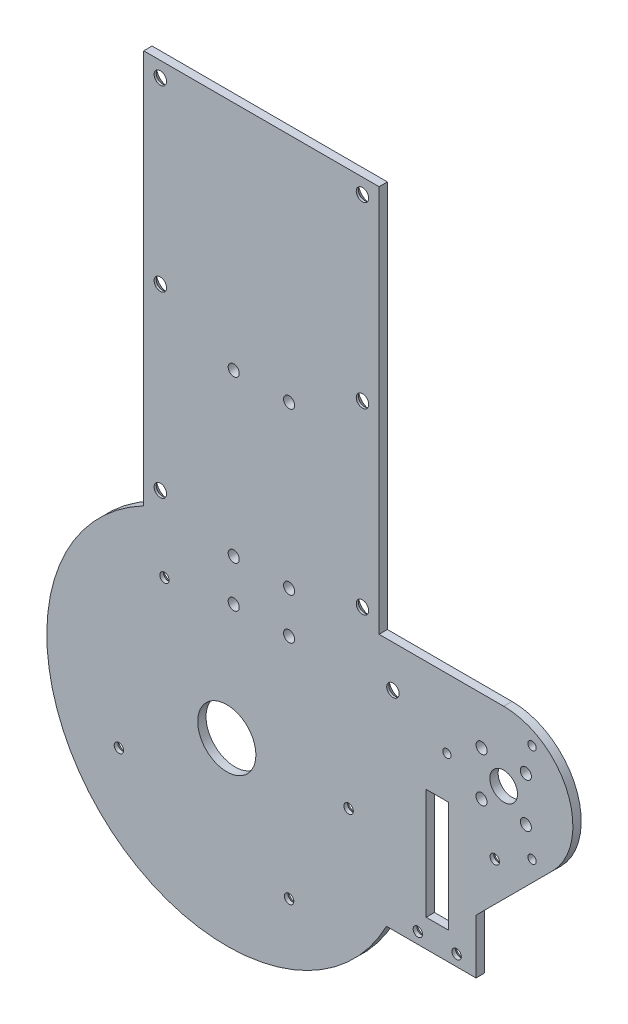
from build123d import *
from build123d.topology import SkipClean

# Parameters (mm, degrees)
SKETCH1_R                     = 10.5
SKETCH1_W                     = 8
SKETCH1_H                     = 40
SKETCH1_R_2                   = 5
BOSS_EXTRUDE1_DEPTH           = 3
CUT_EXTRUDE1_REACH            = 140.687
SKETCH2_R                     = 2
BOSS_EXTRUDE2_DEPTH           = 3
SKETCH5_R                     = 2
CUT_EXTRUDE2_DEPTH            = 10
BOSS_EXTRUDE4_START           = -3
BOSS_EXTRUDE4_DEPTH           = 3
BOSS_EXTRUDE5_START           = -3
SKETCH8_R                     = 65
SKETCH8_R_2                   = 10.5
BOSS_EXTRUDE5_DEPTH           = 3
CUT_EXTRUDE4_START            = -10
CUT_EXTRUDE4_DEPTH            = 10
CUT_EXTRUDE6_REACH            = 237.869
SKETCH11_R                    = 2
CUT_EXTRUDE7_REACH            = 237.869
SKETCH12_R                    = 2
CSK_FOR_M3_SFHCS1_D           = 3.4
CSK_FOR_M3_SFHCS1_DEPTH       = 11.3
CSK_FOR_M3_SFHCS1_CSINK_D     = 6.72
CSK_FOR_M3_SFHCS1_CSINK_ANGLE = 90
CSK_FOR_M3_SFHCS1_TIP         = 1.021463052
CSK_FOR_M4_SFHCS1_D           = 4.5
CSK_FOR_M4_SFHCS1_DEPTH       = 11.3
CSK_FOR_M4_SFHCS1_CSINK_D     = 8.96
CSK_FOR_M4_SFHCS1_CSINK_ANGLE = 90
CSK_FOR_M4_SFHCS1_TIP         = 1.351936393
CSK_FOR_M3_SFHCS2_D           = 3.4
CSK_FOR_M3_SFHCS2_DEPTH       = 11.3
CSK_FOR_M3_SFHCS2_CSINK_D     = 6.72
CSK_FOR_M3_SFHCS2_CSINK_ANGLE = 90
CSK_FOR_M3_SFHCS2_TIP         = 1.021463052
CSK_FOR_M4_SFHCS2_D           = 4.5
CSK_FOR_M4_SFHCS2_DEPTH       = 11.3
CSK_FOR_M4_SFHCS2_CSINK_D     = 8.96
CSK_FOR_M4_SFHCS2_CSINK_ANGLE = 90
CSK_FOR_M4_SFHCS2_TIP         = 1.351936393
CUT_EXTRUDE8_REACH            = 237.869
SKETCH23_R                    = 1.5
CSK_FOR_M3_SFHCS3_D           = 3.4
CSK_FOR_M3_SFHCS3_DEPTH       = 11.3
CSK_FOR_M3_SFHCS3_CSINK_D     = 6.72
CSK_FOR_M3_SFHCS3_CSINK_ANGLE = 90
CSK_FOR_M3_SFHCS3_TIP         = 1.021463052


with BuildPart() as part:
    # Sketch1 → Boss-Extrude1 (new body)
    # profile 1 of 2: a face of its own
    with BuildSketch(Plane.XY):
        with BuildLine():
            ThreePointArc((-60, 0), (-52.867640737, 28.372743309), (-33.166247904, 50))
            Line((-33.166247904, 50), (-60, 50))
            Line((-60, 50), (-60, 0))
        make_face()
    # profile 2 of 2: a face of its own
    with BuildSketch(Plane.XY):
        with BuildLine():
            ThreePointArc((0, 60), (-17.320508076, 57.445626465), (-33.166247904, 50))
            ThreePointArc((-33.166247904, 50), (-52.867640737, 28.372743309), (-60, 0))
            ThreePointArc((-60, 0), (-15.529142706, -57.955549577), (51.961524227, -30))
            Line((51.961524227, -30), (56.882127578, -30))
            Line((56.882127578, -30), (90, -30))
            Line((90, -30), (90, -10.355339059))
            Line((90, -10.355339059), (117.67766953, 17.32233047))
            ThreePointArc((117.67766953, 17.32233047), (123.096988313, 44.567085809), (100, 60))
            Line((100, 60), (0, 60))
        make_face()
        Circle(SKETCH1_R, mode=Mode.SUBTRACT)
        with Locations((76, 0)):
            Rectangle(SKETCH1_W, SKETCH1_H, mode=Mode.SUBTRACT)
        with Locations((100, 35)):
            Circle(SKETCH1_R_2, mode=Mode.SUBTRACT)
    extrude(amount=BOSS_EXTRUDE1_DEPTH)

    # Sketch2 → Cut-Extrude1 (cut, up to next)
    with BuildSketch(Plane.XY.offset(3), mode=Mode.PRIVATE) as cut_extrude1_sk1:
        with Locations((60, 45)):
            Circle(SKETCH2_R)
    cut_extrude1_tool1 = extrude(cut_extrude1_sk1.sketch, amount=-CUT_EXTRUDE1_REACH, mode=Mode.PRIVATE) & part.part
    add(cut_extrude1_tool1.solids().sort_by_distance((60, 45, 3))[0], mode=Mode.SUBTRACT)

    # Sketch3 → Boss-Extrude2 (add)
    with BuildSketch(Plane(origin=(0, 0, 0), x_dir=(-1, 0, 0), z_dir=(0, 0, -1))):
        with BuildLine():
            Line((-30, 80), (-30, 60))
            Line((-30, 60), (0, 60))
            ThreePointArc((0, 60), (2.502176759, 59.947803225), (5, 59.791303716))
            Line((5, 59.791303716), (5, 80))
            Line((5, 80), (-30, 80))
        make_face()
    extrude(amount=-BOSS_EXTRUDE2_DEPTH)

    # Sketch5 → Cut-Extrude2 (cut)
    with BuildSketch(Plane.XY.offset(3)):
        with Locations((92, 43)):
            Circle(SKETCH5_R)
        with Locations((108, 43)):
            Circle(SKETCH5_R)
        with Locations((108, 27)):
            Circle(SKETCH5_R)
        with Locations((92, 27)):
            Circle(SKETCH5_R)
    extrude(amount=-CUT_EXTRUDE2_DEPTH, mode=Mode.SUBTRACT)

    # Sketch6 → Boss-Extrude4 (add)
    with BuildSketch(Plane.XY.offset(3).offset(BOSS_EXTRUDE4_START)):
        with BuildLine():
            Line((12.5, 60), (55, 60))
            Line((55, 60), (55, 200))
            Line((55, 200), (-30, 200))
            Line((-30, 200), (-30, 60))
            Line((-30, 60), (-30, 51.961524227))
            ThreePointArc((-30, 51.961524227), (-17.93255034, 57.257520364), (-5, 59.791303716))
            Line((-5, 59.791303716), (-5, 60))
            Line((-5, 60), (12.5, 60))
        make_face()
    extrude(amount=BOSS_EXTRUDE4_DEPTH)

    # Sketch8 → Boss-Extrude5 (add)
    with BuildSketch(Plane.XY.offset(3).offset(BOSS_EXTRUDE5_START)):
        Circle(SKETCH8_R)
        Circle(SKETCH8_R_2, mode=Mode.SUBTRACT)
    extrude(amount=BOSS_EXTRUDE5_DEPTH)

    # Sketch9 → Cut-Extrude4 (cut)
    with SkipClean():  # the faces are left unmerged after this step: merging them gives an invalid solid
        with BuildSketch(Plane.XY.offset(3).offset(CUT_EXTRUDE4_START)):
            with BuildLine():
                Line((-60, 50), (-60, 25))
                ThreePointArc((-60, 25), (-52.282822987, 38.62002616), (-41.533119315, 50))
                Line((-41.533119315, 50), (-60, 50))
            make_face()
        extrude(amount=CUT_EXTRUDE4_DEPTH, mode=Mode.SUBTRACT)

    # Sketch11 → Cut-Extrude6 (cut, up to next)
    with BuildSketch(Plane(origin=(0, 0, 0), x_dir=(-1, 0, 0), z_dir=(0, 0, -1)), mode=Mode.PRIVATE) as cut_extrude6_sk1:
        with Locations((-2.5, 116.34)):
            Circle(SKETCH11_R)
    cut_extrude6_tool1 = extrude(cut_extrude6_sk1.sketch, amount=-CUT_EXTRUDE6_REACH, mode=Mode.PRIVATE) & part.part
    # Sketch11 → Cut-Extrude6 (cut, up to next)
    with BuildSketch(Plane(origin=(0, 0, 0), x_dir=(-1, 0, 0), z_dir=(0, 0, -1)), mode=Mode.PRIVATE) as cut_extrude6_sk2:
        with Locations((-22.5, 116.34)):
            Circle(SKETCH11_R)
    cut_extrude6_tool2 = extrude(cut_extrude6_sk2.sketch, amount=-CUT_EXTRUDE6_REACH, mode=Mode.PRIVATE) & part.part
    add(cut_extrude6_tool1.solids().sort_by_distance((2.5, 116.34, 0))[0], mode=Mode.SUBTRACT)
    add(cut_extrude6_tool2.solids().sort_by_distance((22.5, 116.34, 0))[0], mode=Mode.SUBTRACT)

    # Sketch12 → Cut-Extrude7 (cut, up to next)
    with BuildSketch(Plane(origin=(0, 0, 0), x_dir=(-1, 0, 0), z_dir=(0, 0, -1)), mode=Mode.PRIVATE) as cut_extrude7_sk1:
        with Locations((-2.5, 58.160508076)):
            Circle(SKETCH12_R)
    cut_extrude7_tool1 = extrude(cut_extrude7_sk1.sketch, amount=-CUT_EXTRUDE7_REACH, mode=Mode.PRIVATE) & part.part
    # Sketch12 → Cut-Extrude7 (cut, up to next)
    with BuildSketch(Plane(origin=(0, 0, 0), x_dir=(-1, 0, 0), z_dir=(0, 0, -1)), mode=Mode.PRIVATE) as cut_extrude7_sk2:
        with Locations((-22.5, 58.160508076)):
            Circle(SKETCH12_R)
    cut_extrude7_tool2 = extrude(cut_extrude7_sk2.sketch, amount=-CUT_EXTRUDE7_REACH, mode=Mode.PRIVATE) & part.part
    # Sketch12 → Cut-Extrude7 (cut, up to next)
    with BuildSketch(Plane(origin=(0, 0, 0), x_dir=(-1, 0, 0), z_dir=(0, 0, -1)), mode=Mode.PRIVATE) as cut_extrude7_sk3:
        with Locations((-2.5, 43.160508076)):
            Circle(SKETCH12_R)
    cut_extrude7_tool3 = extrude(cut_extrude7_sk3.sketch, amount=-CUT_EXTRUDE7_REACH, mode=Mode.PRIVATE) & part.part
    # Sketch12 → Cut-Extrude7 (cut, up to next)
    with BuildSketch(Plane(origin=(0, 0, 0), x_dir=(-1, 0, 0), z_dir=(0, 0, -1)), mode=Mode.PRIVATE) as cut_extrude7_sk4:
        with Locations((-22.5, 43.160508076)):
            Circle(SKETCH12_R)
    cut_extrude7_tool4 = extrude(cut_extrude7_sk4.sketch, amount=-CUT_EXTRUDE7_REACH, mode=Mode.PRIVATE) & part.part
    add(cut_extrude7_tool1.solids().sort_by_distance((2.5, 58.160508, 0))[0], mode=Mode.SUBTRACT)
    add(cut_extrude7_tool2.solids().sort_by_distance((22.5, 58.160508, 0))[0], mode=Mode.SUBTRACT)
    add(cut_extrude7_tool3.solids().sort_by_distance((2.5, 43.160508, 0))[0], mode=Mode.SUBTRACT)
    add(cut_extrude7_tool4.solids().sort_by_distance((22.5, 43.160508, 0))[0], mode=Mode.SUBTRACT)

    # CSK for M3 SFHCS1
    with Locations(Plane(origin=(0, 0, 0), x_dir=(-1, 0, 0), z_dir=(0, 0, -1))):
        with Locations((22.5, 38.97114317), (38.97114317, -22.5), (-22.5, -38.97114317), (-96.767766953, 10.554563517)):
            CounterSinkHole(CSK_FOR_M3_SFHCS1_D / 2, CSK_FOR_M3_SFHCS1_CSINK_D / 2, depth=CSK_FOR_M3_SFHCS1_DEPTH, counter_sink_angle=CSK_FOR_M3_SFHCS1_CSINK_ANGLE)
            with Locations((0, 0, -(CSK_FOR_M3_SFHCS1_DEPTH + CSK_FOR_M3_SFHCS1_TIP / 2))):  # 118° drill point
                Cone(0, CSK_FOR_M3_SFHCS1_D / 2, CSK_FOR_M3_SFHCS1_TIP, mode=Mode.SUBTRACT)

    # CSK for M4 SFHCS1
    with Locations(Plane(origin=(0, 0, 0), x_dir=(-1, 0, 0), z_dir=(0, 0, -1))):
        with Locations((-49, 194.5), (24, 194.5), (24, 130), (-49, 130), (-49, 65.5), (24, 65.5)):
            CounterSinkHole(CSK_FOR_M4_SFHCS1_D / 2, CSK_FOR_M4_SFHCS1_CSINK_D / 2, depth=CSK_FOR_M4_SFHCS1_DEPTH, counter_sink_angle=CSK_FOR_M4_SFHCS1_CSINK_ANGLE)
            with Locations((0, 0, -(CSK_FOR_M4_SFHCS1_DEPTH + CSK_FOR_M4_SFHCS1_TIP / 2))):  # 118° drill point
                Cone(0, CSK_FOR_M4_SFHCS1_D / 2, CSK_FOR_M4_SFHCS1_TIP, mode=Mode.SUBTRACT)

    # CSK for M3 SFHCS2
    with Locations(Plane(origin=(0, 0, 0), x_dir=(-1, 0, 0), z_dir=(0, 0, -1))):
        with Locations((-83, -26), (-69, -26)):
            CounterSinkHole(CSK_FOR_M3_SFHCS2_D / 2, CSK_FOR_M3_SFHCS2_CSINK_D / 2, depth=CSK_FOR_M3_SFHCS2_DEPTH, counter_sink_angle=CSK_FOR_M3_SFHCS2_CSINK_ANGLE)
            with Locations((0, 0, -(CSK_FOR_M3_SFHCS2_DEPTH + CSK_FOR_M3_SFHCS2_TIP / 2))):  # 118° drill point
                Cone(0, CSK_FOR_M3_SFHCS2_D / 2, CSK_FOR_M3_SFHCS2_TIP, mode=Mode.SUBTRACT)

    # CSK for M4 SFHCS2
    with Locations(Plane(origin=(0, 0, 0), x_dir=(-1, 0, 0), z_dir=(0, 0, -1))):
        with Locations((-60, 45)):
            CounterSinkHole(CSK_FOR_M4_SFHCS2_D / 2, CSK_FOR_M4_SFHCS2_CSINK_D / 2, depth=CSK_FOR_M4_SFHCS2_DEPTH, counter_sink_angle=CSK_FOR_M4_SFHCS2_CSINK_ANGLE)
            with Locations((0, 0, -(CSK_FOR_M4_SFHCS2_DEPTH + CSK_FOR_M4_SFHCS2_TIP / 2))):  # 118° drill point
                Cone(0, CSK_FOR_M4_SFHCS2_D / 2, CSK_FOR_M4_SFHCS2_TIP, mode=Mode.SUBTRACT)

    # Sketch23 → Cut-Extrude8 (cut, up to next)
    with BuildSketch(Plane(origin=(0, 0, 0), x_dir=(-1, 0, 0), z_dir=(0, 0, -1)), mode=Mode.PRIVATE) as cut_extrude8_sk1:
        with Locations((-79.5, 35)):
            Circle(SKETCH23_R)
    cut_extrude8_tool1 = extrude(cut_extrude8_sk1.sketch, amount=-CUT_EXTRUDE8_REACH, mode=Mode.PRIVATE) & part.part
    # Sketch23 → Cut-Extrude8 (cut, up to next)
    with BuildSketch(Plane(origin=(0, 0, 0), x_dir=(-1, 0, 0), z_dir=(0, 0, -1)), mode=Mode.PRIVATE) as cut_extrude8_sk2:
        with Locations((-110.25, 17.246479222)):
            Circle(SKETCH23_R)
    cut_extrude8_tool2 = extrude(cut_extrude8_sk2.sketch, amount=-CUT_EXTRUDE8_REACH, mode=Mode.PRIVATE) & part.part
    # Sketch23 → Cut-Extrude8 (cut, up to next)
    with BuildSketch(Plane(origin=(0, 0, 0), x_dir=(-1, 0, 0), z_dir=(0, 0, -1)), mode=Mode.PRIVATE) as cut_extrude8_sk3:
        with Locations((-110.25, 52.753520778)):
            Circle(SKETCH23_R)
    cut_extrude8_tool3 = extrude(cut_extrude8_sk3.sketch, amount=-CUT_EXTRUDE8_REACH, mode=Mode.PRIVATE) & part.part
    add(cut_extrude8_tool1.solids().sort_by_distance((79.5, 35, 0))[0], mode=Mode.SUBTRACT)
    add(cut_extrude8_tool2.solids().sort_by_distance((110.25, 17.246479, 0))[0], mode=Mode.SUBTRACT)
    add(cut_extrude8_tool3.solids().sort_by_distance((110.25, 52.753521, 0))[0], mode=Mode.SUBTRACT)

    # CSK for M3 SFHCS3
    with Locations(Plane(origin=(0, 0, 0), x_dir=(-1, 0, 0), z_dir=(0, 0, -1))):
        with Locations((-44, 0)):
            CounterSinkHole(CSK_FOR_M3_SFHCS3_D / 2, CSK_FOR_M3_SFHCS3_CSINK_D / 2, depth=CSK_FOR_M3_SFHCS3_DEPTH, counter_sink_angle=CSK_FOR_M3_SFHCS3_CSINK_ANGLE)
            with Locations((0, 0, -(CSK_FOR_M3_SFHCS3_DEPTH + CSK_FOR_M3_SFHCS3_TIP / 2))):  # 118° drill point
                Cone(0, CSK_FOR_M3_SFHCS3_D / 2, CSK_FOR_M3_SFHCS3_TIP, mode=Mode.SUBTRACT)


solid = part.part
